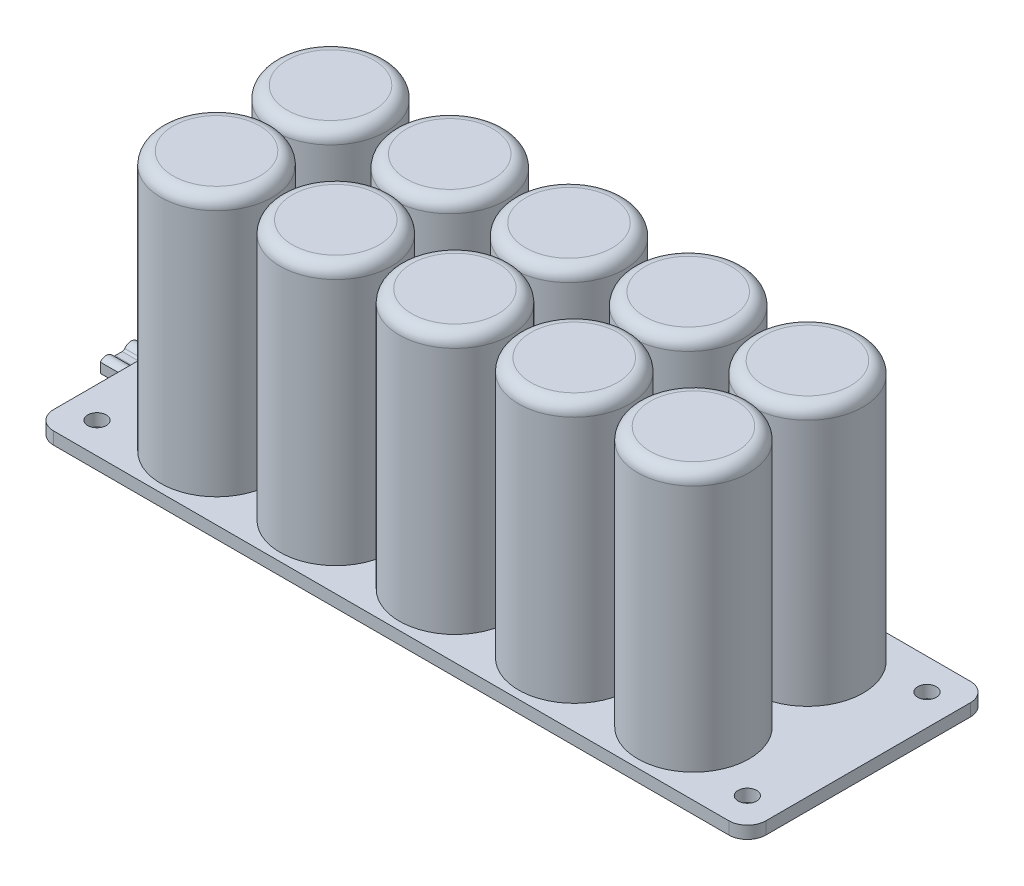
from build123d import *

# Parameters (mm, degrees)
EXTRUDE_1_DEPTH     = 2
SKETCH_2_R          = 9
EXTRUDE_3_DEPTH     = 42
FILLET_1_R          = 2
SKETCH_4_R          = 1.5
CUT_EXTRUDE_1_DEPTH = 75.98333154
SKETCH_5_W          = 13
SKETCH_5_H          = 3.85
EXTRUDE_4_DEPTH     = 10
SKETCH_6_R          = 0.75
EXTRUDE_5_DEPTH     = 6


with BuildPart() as part:
    # 草图1 → 凸台-拉伸1 (new body)
    with BuildSketch(Plane(origin=(0, 0, 0), x_dir=(1, 0, 0), z_dir=(0, 1, 0))):
        with BuildLine():
            Line((-54.5, 19.5), (54.5, 19.5))
            ThreePointArc((54.5, 19.5), (56.621320344, 18.621320344), (57.5, 16.5))
            Line((57.5, 16.5), (57.5, -16.5))
            ThreePointArc((57.5, -16.5), (56.621320344, -18.621320344), (54.5, -19.5))
            Line((54.5, -19.5), (-54.5, -19.5))
            ThreePointArc((-54.5, -19.5), (-56.621320344, -18.621320344), (-57.5, -16.5))
            Line((-57.5, -16.5), (-57.5, 16.5))
            ThreePointArc((-57.5, 16.5), (-56.621320344, 18.621320344), (-54.5, 19.5))
        make_face()
    extrude(amount=EXTRUDE_1_DEPTH)

    # 草图2 → 凸台-拉伸3 (add)
    with BuildSketch(Plane(origin=(0, 2, 0), x_dir=(1, 0, 0), z_dir=(0, 1, 0))):
        with Locations(Location((0, 9.2, 0), (0, 0, 90))):
            Circle(SKETCH_2_R)
        with Locations(Location((-19.25, 9.2, 0), (0, 0, 90))):
            Circle(SKETCH_2_R)
        with Locations(Location((-38.5, 9.2, 0), (0, 0, 90))):
            Circle(SKETCH_2_R)
        with Locations(Location((19.25, 9.2, 0), (0, 0, 90))):
            Circle(SKETCH_2_R)
        with Locations(Location((38.5, 9.2, 0), (0, 0, 90))):
            Circle(SKETCH_2_R)
        with Locations(Location((38.5, -9.2, 0), (0, 0, 90))):
            Circle(SKETCH_2_R)
        with Locations(Location((19.25, -9.2, 0), (0, 0, 90))):
            Circle(SKETCH_2_R)
        with Locations(Location((-38.5, -9.2, 0), (0, 0, 90))):
            Circle(SKETCH_2_R)
        with Locations(Location((-19.25, -9.2, 0), (0, 0, 90))):
            Circle(SKETCH_2_R)
        with Locations(Location((0, -9.2, 0), (0, 0, 90))):
            Circle(SKETCH_2_R)
    extrude(amount=EXTRUDE_3_DEPTH)

    # 圆角1
    fillet_1_edges = [part.edges().sort_by_distance(p)[0] for p in [
        (0, 44, -0.2),
        (-19.25, 44, -0.2),
        (-38.5, 44, -0.2),
        (19.25, 44, -0.2),
        (38.5, 44, -0.2),
        (38.5, 44, 18.2),
        (19.25, 44, 18.2),
        (-38.5, 44, 18.2),
        (-19.25, 44, 18.2),
        (0, 44, 18.2),
    ]]
    fillet(fillet_1_edges, radius=FILLET_1_R)

    # 草图4 → 切除-拉伸1 (cut, through all)
    with BuildSketch(Plane.XZ):
        with Locations(Location((-52.5, 14.5, 0), (0, 0, 270))):
            Circle(SKETCH_4_R)
        with Locations(Location((-52.5, -14.5, 0), (0, 0, 270))):
            Circle(SKETCH_4_R)
        with Locations(Location((52.5, -14.5, 0), (0, 0, 270))):
            Circle(SKETCH_4_R)
        with Locations(Location((52.5, 14.5, 0), (0, 0, 270))):
            Circle(SKETCH_4_R)
    extrude(amount=-CUT_EXTRUDE_1_DEPTH, mode=Mode.SUBTRACT)

    # 草图5 → 凸台-拉伸4 (add)
    with BuildSketch(Plane.ZY.offset(57.5)):
        with Locations((0, -1.925)):
            Rectangle(SKETCH_5_W, SKETCH_5_H)
    extrude(amount=-EXTRUDE_4_DEPTH)

    # 草图6 → 凸台-拉伸5 (add)
    with BuildSketch(Plane.ZY.offset(57.5)):
        with BuildLine():
            Line((-0.563859338, -1.425), (0.563859338, -1.425))
            ThreePointArc((0.563859338, -1.425), (0.795314363, -1.36820263), (0.974185242, -1.210714286))
            ThreePointArc((0.974185242, -1.210714286), (1.954468576, -0.675829519), (2.971091293, -1.137928402))
            Line((2.971091293, -1.137928402), (2.971091293, -2.712071598))
            ThreePointArc((2.971091293, -2.712071598), (1.954468576, -3.174170481), (0.974185242, -2.639285714))
            ThreePointArc((0.974185242, -2.639285714), (0.795314363, -2.48179737), (0.563859338, -2.425))
            Line((0.563859338, -2.425), (-0.563859338, -2.425))
            ThreePointArc((-0.563859338, -2.425), (-0.795314363, -2.48179737), (-0.974185242, -2.639285714))
            ThreePointArc((-0.974185242, -2.639285714), (-3.25, -1.925), (-0.974185242, -1.210714286))
            ThreePointArc((-0.974185242, -1.210714286), (-0.795314363, -1.36820263), (-0.563859338, -1.425))
        make_face()
        with Locations((-2, -1.925)):
            Circle(SKETCH_6_R, mode=Mode.SUBTRACT)
        with Locations((2, -1.925)):
            Circle(SKETCH_6_R, mode=Mode.SUBTRACT)
    extrude(amount=EXTRUDE_5_DEPTH)


solid = part.part
